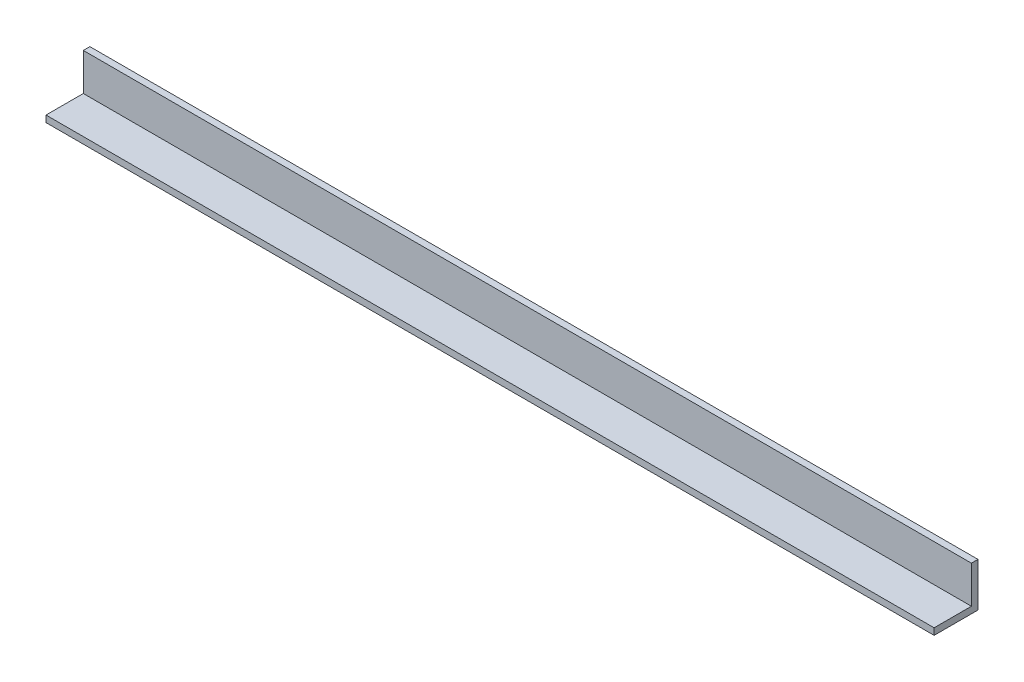
from build123d import *

# Parameters (mm, degrees)
SKETCH_1_W          = 1619
SKETCH_1_H          = 80
EXTRUDE_1_DEPTH     = 80
SKETCH_3_W          = 68
SKETCH_3_H          = 68
CUT_EXTRUDE_2_DEPTH = 1623.948243167


with BuildPart() as part:
    # 草图1 → 拉伸1 (new body)
    with BuildSketch(Plane.XY):
        with Locations((809.5, 40)):
            Rectangle(SKETCH_1_W, SKETCH_1_H)
    extrude(amount=EXTRUDE_1_DEPTH)

    # 草图3 → 拉伸2 (cut, through all)
    with BuildSketch(Plane.ZY):
        with Locations((46, 46)):
            Rectangle(SKETCH_3_W, SKETCH_3_H)
    extrude(amount=-CUT_EXTRUDE_2_DEPTH, mode=Mode.SUBTRACT)


solid = part.part
